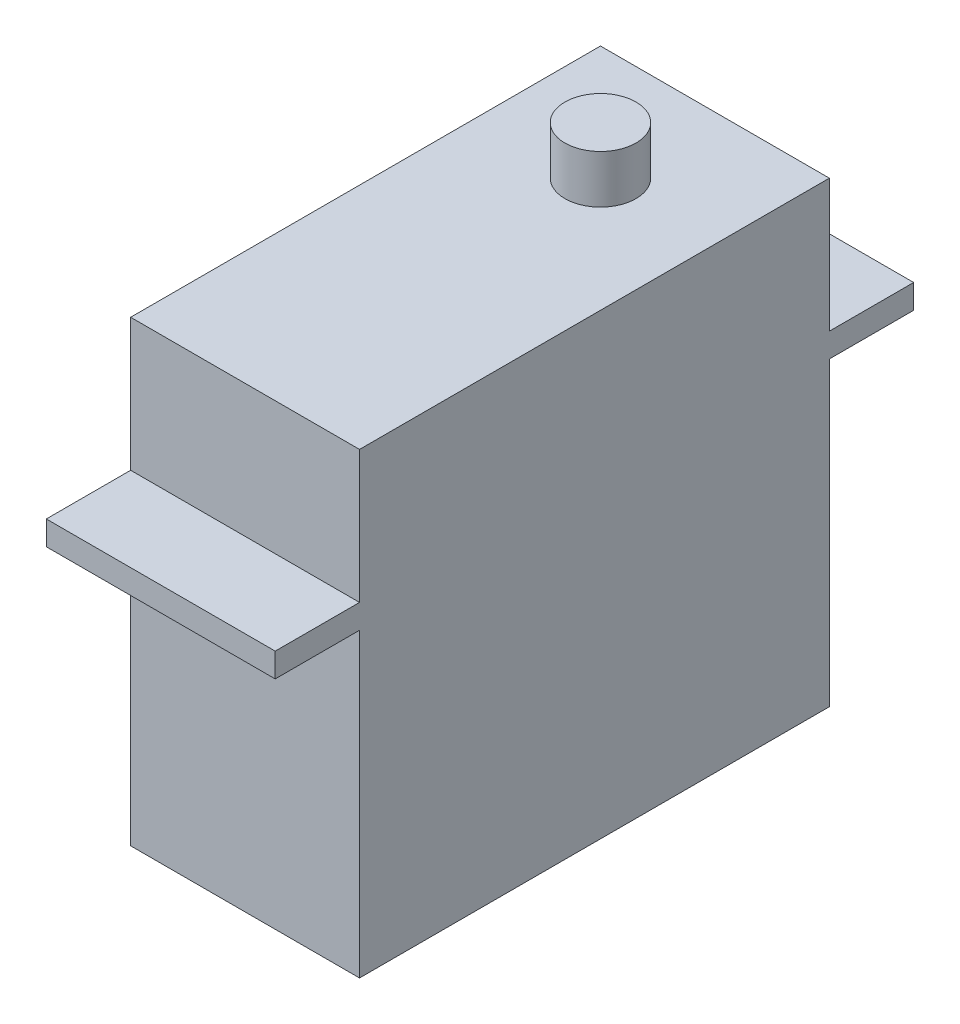
from build123d import *

# Parameters (mm, degrees)
ESQUISSE1_W             = 19
ESQUISSE1_H             = 39
BOSS_EXTRU_1_DEPTH      = 38
BOSS_EXTRU_2_DEPTH      = 7
BOSS_EXTRU_2_DEPTH_BACK = 46
ESQUISSE2_W             = 19
ESQUISSE2_H             = 2
ESQUISSE3_R             = 2.95
BOSS_EXTRU_3_DEPTH      = 4


with BuildPart() as part:
    # Esquisse1 → Boss.-Extru.1 (new body)
    with BuildSketch(Plane(origin=(0, 0, 0), x_dir=(1, 0, 0), z_dir=(0, 1, 0))):
        with Locations((-9.5, 19.5)):
            Rectangle(ESQUISSE1_W, ESQUISSE1_H)
    extrude(amount=BOSS_EXTRU_1_DEPTH)

    # Esquisse2 → Boss.-Extru.2 (add, two sides: drawn at the far end of the back side and taken through both)
    with BuildSketch(Plane(origin=(0, 0, -39), x_dir=(-1, 0, 0), z_dir=(0, 0, -1)).offset(-BOSS_EXTRU_2_DEPTH_BACK)):
        with Locations((9.5, 26)):
            Rectangle(ESQUISSE2_W, ESQUISSE2_H)
    extrude(amount=BOSS_EXTRU_2_DEPTH + BOSS_EXTRU_2_DEPTH_BACK)

    # Esquisse3 → Boss.-Extru.3 (add)
    with BuildSketch(Plane(origin=(0, 38, 0), x_dir=(1, 0, 0), z_dir=(0, 1, 0))):
        with Locations(Location((-9.5, 29.5, 0), (0, 0, 270))):
            Circle(ESQUISSE3_R)
    extrude(amount=BOSS_EXTRU_3_DEPTH)


solid = part.part
